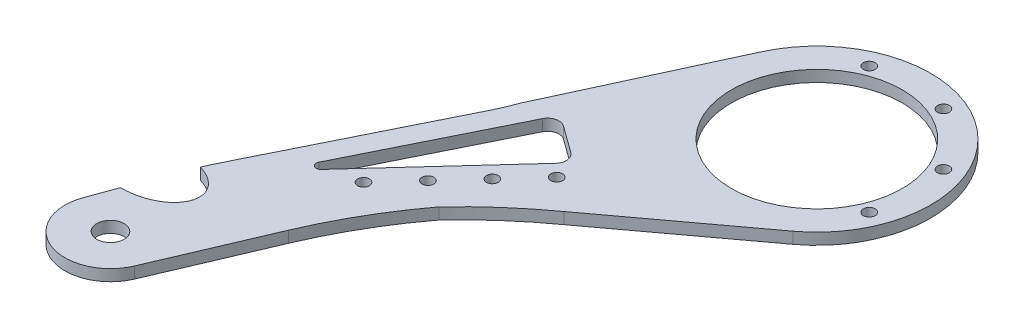
from build123d import *

# Parameters (mm, degrees)
SKETCH_4_R          = 6
SKETCH_4_R_2        = 37.5
SKETCH_4_R_3        = 2.6
EXTRUDE_1_DEPTH     = 5
SKETCH_5_R          = 2.6
CUT_EXTRUDE_1_DEPTH = 5


with BuildPart() as part:
    # 草图4 → 凸台-拉伸1 (new body)
    with BuildSketch(Plane(origin=(0, 0, 0), x_dir=(1, 0, 0), z_dir=(0, 1, 0))):
        with BuildLine():
            Line((-1.187051208, 97.756382931), (-34.399966732, 25.661973505))
            ThreePointArc((-34.399966732, 25.661973505), (-36.436671314, 20.514211828), (-38.755127266, 15.487047832))
            Line((-38.755127266, 15.487047832), (-76.702239109, -61.142758857))
            ThreePointArc((-76.702239109, -61.142758857), (-78.581308529, -65.042906811), (-80.375519882, -68.982813099))
            add(Edge.make_bspline(
                [(-90.080878885, -94.318710442), (-73.900652668, -94.557787877), (-69.815317221, -83.892995419), (-65.729981774, -73.228202961), (-80.375519882, -68.982813099)],
                knots=[1.469085418, 1.469085418, 1.469085418, 2.850930512, 2.850930512, 4.232775606, 4.232775606, 4.232775606], degree=2, weights=[1, 0.770658452, 1, 0.770658452, 1]))
            Line((-90.080878885, -94.318710442), (-94.447090172, -106.314777361))
            ThreePointArc((-94.447090172, -106.314777361), (-82.99415066, -131.759238863), (-57.252299544, -120.991344654))
            Line((-57.252299544, -120.991344654), (-37.073490807, -73.607319444))
            ThreePointArc((-37.073490807, -73.607319444), (-26.275484562, -51.979867968), (-12.947104361, -31.813116187))
            ThreePointArc((-12.947104361, -31.813116187), (1.038966567, -18.243877447), (16.279183802, -6.100146611))
            Line((16.279183802, -6.100146611), (73.992008997, 36.661223905))
            ThreePointArc((73.992008997, 36.661223905), (75.759044699, 115.638002674), (-1.187051208, 97.756382931))
        make_face()
        with Locations(Location((-75.653237756, -113.155180227, 0), (0, 0, 270))):
            Circle(SKETCH_4_R, mode=Mode.SUBTRACT)
        with Locations(Location((44.225629177, 76.835377691, 0), (0, 0, 270))):
            Circle(SKETCH_4_R_2, mode=Mode.SUBTRACT)
        with Locations(Location((-38.804653771, -38.995185245, 0), (0, 0, 270))):
            Circle(SKETCH_4_R_3, mode=Mode.SUBTRACT)
        with Locations(Location((-11.835571633, -9.45422032, 0), (0, 0, 270))):
            Circle(SKETCH_4_R_3, mode=Mode.SUBTRACT)
        with Locations(Location((-25.320112702, -24.224702783, 0), (0, 0, 270))):
            Circle(SKETCH_4_R_3, mode=Mode.SUBTRACT)
        with Locations(Location((1.648969436, 5.316262142, 0), (0, 0, 270))):
            Circle(SKETCH_4_R_3, mode=Mode.SUBTRACT)
        with BuildLine():
            Line((-23.760910885, 24.444490758), (-56.249753951, -41.162972966))
            ThreePointArc((-56.249753951, -41.162972966), (-55.586524246, -43.701342116), (-52.980423674, -43.398965873))
            Line((-52.980423674, -43.398965873), (-3.889961488, 10.372965042))
            ThreePointArc((-3.889961488, 10.372965042), (-2.608449448, 14.252041571), (-4.647570443, 17.792026514))
            Line((-4.647570443, 17.792026514), (-16.345194148, 26.273569961))
            ThreePointArc((-16.345194148, 26.273569961), (-20.477567373, 27.080159725), (-23.760910885, 24.444490758))
        make_face(mode=Mode.SUBTRACT)
    extrude(amount=EXTRUDE_1_DEPTH)

    # 草图5 → 切除-拉伸1 (cut)
    with BuildSketch(Plane(origin=(0, 5, 0), x_dir=(1, 0, 0), z_dir=(0, 1, 0))):
        with Locations(Location((60.489675053, 116.100257823, 0), (0, 0, 270))):
            Circle(SKETCH_5_R)
        with Locations(Location((83.490509309, 93.099423567, 0), (0, 0, 270))):
            Circle(SKETCH_5_R)
        with Locations(Location((83.490509309, 60.571331816, 0), (0, 0, 270))):
            Circle(SKETCH_5_R)
        with Locations(Location((27.961583302, 116.100257823, 0), (0, 0, 270))):
            Circle(SKETCH_5_R)
    extrude(amount=-CUT_EXTRUDE_1_DEPTH, mode=Mode.SUBTRACT)


solid = part.part
